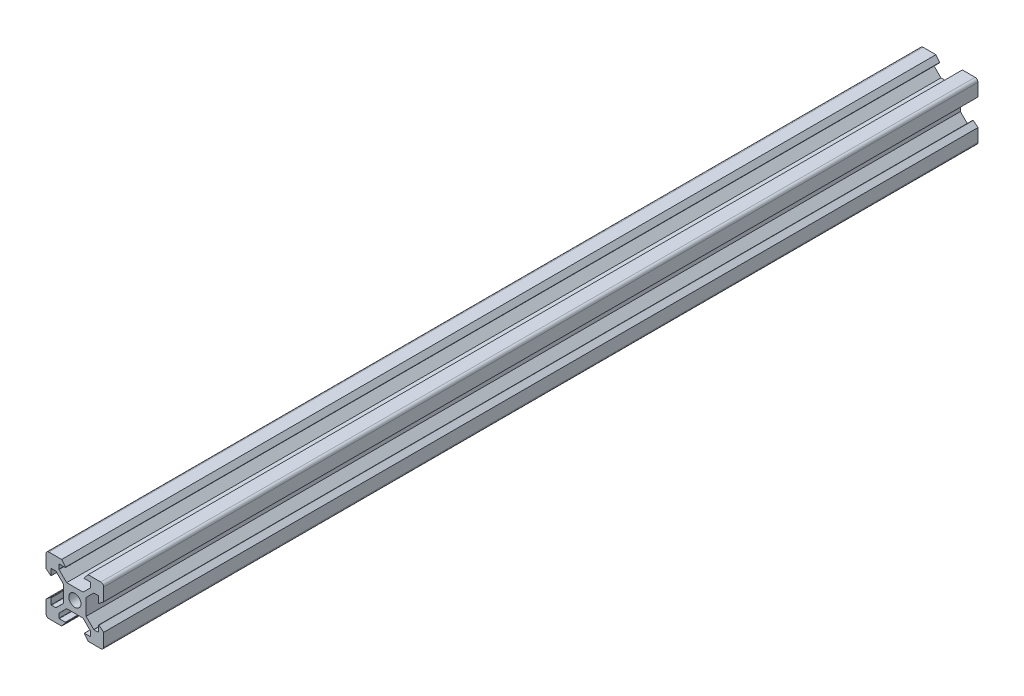
from build123d import *

# Parameters (mm, degrees)
SKETCH1_R           = 2.1
BOSS_EXTRUDE1_DEPTH = 303
FILLET1_R           = 1


with BuildPart() as part:
    # Sketch1 → Boss-Extrude1 (new body)
    with BuildSketch(Plane.XY):
        with BuildLine():
            Line((-2.839339828, 3.9), (-5.470710678, 6.53137085))
            ThreePointArc((-5.470710678, 6.53137085), (-5.492387953, 6.563813185), (-5.5, 6.602081528))
            Line((-5.5, 6.602081528), (-5.5, 8.1))
            ThreePointArc((-5.5, 8.1), (-5.470710678, 8.170710678), (-5.4, 8.2))
            Line((-5.4, 8.2), (-3.334418044, 8.2))
            ThreePointArc((-3.334418044, 8.2), (-3.244178397, 8.256909326), (-3.2566483, 8.362863876))
            Line((-3.2566483, 8.362863876), (-4.58, 10))
            Line((-4.58, 10), (-10, 10))
            Line((-10, 10), (-10, 4.58))
            Line((-10, 4.58), (-8.362863876, 3.2566483))
            ThreePointArc((-8.362863876, 3.2566483), (-8.256909326, 3.244178397), (-8.2, 3.334418044))
            Line((-8.2, 3.334418044), (-8.2, 5.4))
            ThreePointArc((-8.2, 5.4), (-8.170710678, 5.470710678), (-8.1, 5.5))
            Line((-8.1, 5.5), (-6.602081528, 5.5))
            ThreePointArc((-6.602081528, 5.5), (-6.563813185, 5.492387953), (-6.53137085, 5.470710678))
            Line((-6.53137085, 5.470710678), (-3.9, 2.839339828))
            Line((-3.9, 2.839339828), (-3.9, -2.839339828))
            Line((-3.9, -2.839339828), (-6.53137085, -5.470710678))
            ThreePointArc((-6.53137085, -5.470710678), (-6.563813185, -5.492387953), (-6.602081528, -5.5))
            Line((-6.602081528, -5.5), (-8.1, -5.5))
            ThreePointArc((-8.1, -5.5), (-8.170710678, -5.470710678), (-8.2, -5.4))
            Line((-8.2, -5.4), (-8.2, -3.334418044))
            ThreePointArc((-8.2, -3.334418044), (-8.256909326, -3.244178397), (-8.362863876, -3.2566483))
            Line((-8.362863876, -3.2566483), (-10, -4.58))
            Line((-10, -4.58), (-10, -10))
            Line((-10, -10), (-4.58, -10))
            Line((-4.58, -10), (-3.2566483, -8.362863876))
            ThreePointArc((-3.2566483, -8.362863876), (-3.244178397, -8.256909326), (-3.334418044, -8.2))
            Line((-3.334418044, -8.2), (-5.4, -8.2))
            ThreePointArc((-5.4, -8.2), (-5.470710678, -8.170710678), (-5.5, -8.1))
            Line((-5.5, -8.1), (-5.5, -6.602081528))
            ThreePointArc((-5.5, -6.602081528), (-5.492387953, -6.563813185), (-5.470710678, -6.53137085))
            Line((-5.470710678, -6.53137085), (-2.839339828, -3.9))
            Line((-2.839339828, -3.9), (2.839339828, -3.9))
            Line((2.839339828, -3.9), (5.470710678, -6.53137085))
            ThreePointArc((5.470710678, -6.53137085), (5.492387953, -6.563813185), (5.5, -6.602081528))
            Line((5.5, -6.602081528), (5.5, -8.1))
            ThreePointArc((5.5, -8.1), (5.470710678, -8.170710678), (5.4, -8.2))
            Line((5.4, -8.2), (3.334418044, -8.2))
            ThreePointArc((3.334418044, -8.2), (3.244178397, -8.256909326), (3.2566483, -8.362863876))
            Line((3.2566483, -8.362863876), (4.58, -10))
            Line((4.58, -10), (10, -10))
            Line((10, -10), (10, -4.58))
            Line((10, -4.58), (8.362863876, -3.2566483))
            ThreePointArc((8.362863876, -3.2566483), (8.256909326, -3.244178397), (8.2, -3.334418044))
            Line((8.2, -3.334418044), (8.2, -5.4))
            ThreePointArc((8.2, -5.4), (8.170710678, -5.470710678), (8.1, -5.5))
            Line((8.1, -5.5), (6.602081528, -5.5))
            ThreePointArc((6.602081528, -5.5), (6.563813185, -5.492387953), (6.53137085, -5.470710678))
            Line((6.53137085, -5.470710678), (3.9, -2.839339828))
            Line((3.9, -2.839339828), (3.9, 2.839339828))
            Line((3.9, 2.839339828), (6.53137085, 5.470710678))
            ThreePointArc((6.53137085, 5.470710678), (6.563813185, 5.492387953), (6.602081528, 5.5))
            Line((6.602081528, 5.5), (8.1, 5.5))
            ThreePointArc((8.1, 5.5), (8.170710678, 5.470710678), (8.2, 5.4))
            Line((8.2, 5.4), (8.2, 3.334418044))
            ThreePointArc((8.2, 3.334418044), (8.256909326, 3.244178397), (8.362863876, 3.2566483))
            Line((8.362863876, 3.2566483), (10, 4.58))
            Line((10, 4.58), (10, 10))
            Line((10, 10), (4.58, 10))
            Line((4.58, 10), (3.2566483, 8.362863876))
            ThreePointArc((3.2566483, 8.362863876), (3.244178397, 8.256909326), (3.334418044, 8.2))
            Line((3.334418044, 8.2), (5.4, 8.2))
            ThreePointArc((5.4, 8.2), (5.470710678, 8.170710678), (5.5, 8.1))
            Line((5.5, 8.1), (5.5, 6.602081528))
            ThreePointArc((5.5, 6.602081528), (5.492387953, 6.563813185), (5.470710678, 6.53137085))
            Line((5.470710678, 6.53137085), (2.839339828, 3.9))
            Line((2.839339828, 3.9), (-2.839339828, 3.9))
        make_face()
        Circle(SKETCH1_R, mode=Mode.SUBTRACT)
    extrude(amount=BOSS_EXTRUDE1_DEPTH)

    # Fillet1
    fillet1_edges = [part.edges().sort_by_distance(p)[0] for p in [
        (10, -10, 151.5),
        (-10, -10, 151.5),
        (-10, 10, 151.5),
        (10, 10, 151.5),
    ]]
    fillet(fillet1_edges, radius=FILLET1_R)


solid = part.part
